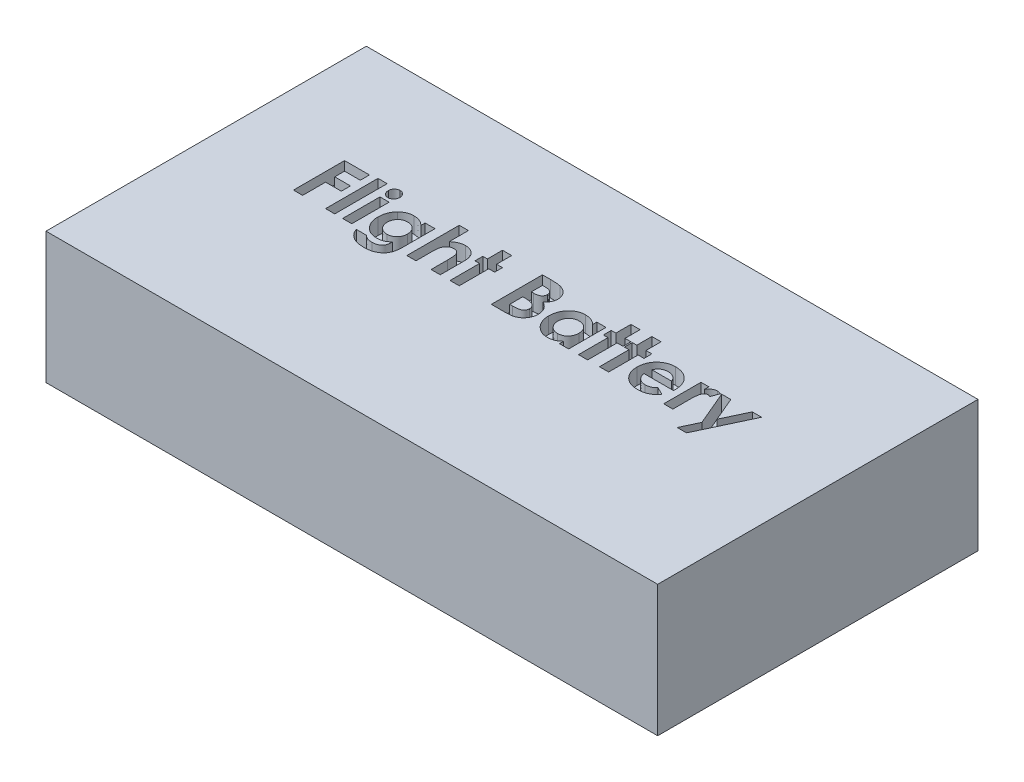
from build123d import *

# Parameters (mm, degrees)
SKETCH1_W           = 38
SKETCH1_H           = 19.9
BOSS_EXTRUDE1_DEPTH = 8.15
SKETCH3_W           = 0.569871795
SKETCH3_H           = 3.256410256
SKETCH3_H_2         = 2.320192307
CUT_EXTRUDE1_DEPTH  = 1


with BuildPart() as part:
    # Sketch1 → Boss-Extrude1 (new body)
    with BuildSketch(Plane(origin=(0, 0, 0), x_dir=(1, 0, 0), z_dir=(0, 1, 0))):
        with Locations((0.345454545, -0.277272727)):
            Rectangle(SKETCH1_W, SKETCH1_H)
    extrude(amount=BOSS_EXTRUDE1_DEPTH)

    # Sketch3 → Cut-Extrude1 (cut)
    # profile 1 of 14: a face of its own
    with BuildSketch(Plane(origin=(0, 8.15, 0), x_dir=(1, 0, 0), z_dir=(0, 1, 0))):
        Polygon((-13.17740164, 2.844430953), (-11.630606768, 2.844430953), (-11.630606768, 2.274559158), (-12.607529845, 2.274559158), (-12.607529845, 1.663982235), (-11.630606768, 1.663982235), (-11.630606768, 1.09411044), (-12.607529845, 1.09411044), (-12.607529845, -0.330569047), (-13.17740164, -0.330569047), align=None)
    # profile 2 of 14: a face of its own
    with BuildSketch(Plane(origin=(0, 8.15, 0), x_dir=(1, 0, 0), z_dir=(0, 1, 0))):
        with Locations((-10.897914461, 1.297636081)):
            Rectangle(SKETCH3_W, SKETCH3_H)
    # profile 3 of 14: a face of its own
    with BuildSketch(Plane(origin=(0, 8.15, 0), x_dir=(1, 0, 0), z_dir=(0, 1, 0))):
        with BuildLine():
            add(Edge.make_bspline(
                [(-9.840853162, 2.966546337), (-9.816291692, 2.965341259), (-9.768062879, 2.96297497), (-9.69896854, 2.939908925), (-9.635553941, 2.903707456), (-9.579493676, 2.854038178), (-9.53286799, 2.794723975), (-9.497244235, 2.728317781), (-9.477399725, 2.654741856), (-9.474643616, 2.603916378), (-9.473234973, 2.577939566)],
                knots=[0, 0, 0, 0, 0.989868614, 1.943702388, 2.910836514, 3.924849579, 4.949916355, 5.946401046, 6.950409252, 8, 8, 8, 8], degree=3))
            add(Edge.make_bspline(
                [(-9.473234973, 2.577939566), (-9.474593217, 2.55215419), (-9.477239819, 2.501910156), (-9.497700968, 2.429333059), (-9.53189491, 2.362959119), (-9.578898235, 2.304525842), (-9.634350733, 2.255656517), (-9.696379675, 2.218797832), (-9.764811889, 2.197014945), (-9.812292337, 2.194450849), (-9.836401039, 2.193148901)],
                knots=[0, 0, 0, 0, 1.05296456, 2.051751585, 3.055639087, 4.085634717, 5.099016424, 6.062201612, 7.016062274, 8, 8, 8, 8], degree=3))
            add(Edge.make_bspline(
                [(-9.836401039, 2.193148901), (-9.861176911, 2.194349672), (-9.909825313, 2.196707433), (-9.979486367, 2.219827448), (-10.043746755, 2.255743807), (-10.09956383, 2.306427905), (-10.146723485, 2.366163581), (-10.180791181, 2.434115768), (-10.202101367, 2.508194803), (-10.204630868, 2.559773042), (-10.205927281, 2.586207796)],
                knots=[0, 0, 0, 0, 0.989065327, 1.942068821, 2.907541208, 3.917690034, 4.939857478, 5.938239964, 6.943311734, 8, 8, 8, 8], degree=3))
            add(Edge.make_bspline(
                [(-10.205927281, 2.586207796), (-10.204516429, 2.611555321), (-10.201745013, 2.661346875), (-10.181781632, 2.733286991), (-10.146974728, 2.798576793), (-10.100684891, 2.856805194), (-10.045117025, 2.905547954), (-9.981740494, 2.94064996), (-9.913111163, 2.962763312), (-9.865187862, 2.965272308), (-9.840853162, 2.966546337)],
                knots=[0, 0, 0, 0, 1.038616768, 2.040212704, 3.031499824, 4.052181184, 5.074969369, 6.039807101, 7.004644834, 8, 8, 8, 8], degree=3))
        make_face()
    # profile 4 of 14: a face of its own
    with BuildSketch(Plane(origin=(0, 8.15, 0), x_dir=(1, 0, 0), z_dir=(0, 1, 0))):
        with Locations((-9.839581128, 0.829527107)):
            Rectangle(SKETCH3_W, SKETCH3_H_2)
    # profile 5 of 14: a face of its own
    with BuildSketch(Plane(origin=(0, 8.15, 0), x_dir=(1, 0, 0), z_dir=(0, 1, 0))):
        with BuildLine():
            Line((-7.315863178, 1.98962326), (-6.705286255, 1.98962326))
            Line((-6.705286255, 1.98962326), (-6.705286255, 0.010336401))
            add(Edge.make_bspline(
                [(-6.705286255, 0.010336401), (-6.70602001, -0.036962251), (-6.707436918, -0.128297806), (-6.718245501, -0.260666617), (-6.736270207, -0.383379785), (-6.762207122, -0.496611102), (-6.795705895, -0.599944387), (-6.836676165, -0.693723175), (-6.884284921, -0.778450374), (-6.923429916, -0.82795851), (-6.942520831, -0.852103502)],
                knots=[0, 0, 0, 0, 1.243822755, 2.401870584, 3.490053692, 4.503076575, 5.453444971, 6.342269266, 7.191528908, 8, 8, 8, 8], degree=3))
            add(Edge.make_bspline(
                [(-6.942520831, -0.852103502), (-6.969935648, -0.882174431), (-7.024626489, -0.942164046), (-7.121049506, -1.017868818), (-7.226684473, -1.082572327), (-7.342609413, -1.135599953), (-7.468686247, -1.175990087), (-7.604591095, -1.205078183), (-7.750410117, -1.223195619), (-7.851123414, -1.225101774), (-7.902907449, -1.226081868)],
                knots=[0, 0, 0, 0, 0.916003385, 1.827369254, 2.751972866, 3.703651841, 4.69362366, 5.730423306, 6.83304546, 8, 8, 8, 8], degree=3))
            add(Edge.make_bspline(
                [(-7.902907449, -1.226081868), (-7.95764617, -1.225234446), (-8.062922826, -1.223604637), (-8.21420321, -1.207661363), (-8.352005062, -1.181427807), (-8.476975498, -1.144494677), (-8.590278802, -1.096840259), (-8.694051588, -1.039699862), (-8.788094563, -0.971383814), (-8.873829231, -0.894585377), (-8.949267243, -0.80761802), (-9.013683904, -0.711277987), (-9.06856355, -0.606451415), (-9.095661, -0.531488425), (-9.10943289, -0.49338956)],
                knots=[0, 0, 0, 0, 1.29412125, 2.488928388, 3.592140377, 4.607309753, 5.564519828, 6.493640275, 7.402258018, 8.307438948, 9.210158992, 10.116782752, 11.042881838, 12, 12, 12, 12], degree=3))
            Line((-9.10943289, -0.49338956), (-8.475959332, -0.49338956))
            add(Edge.make_bspline(
                [(-8.475959332, -0.49338956), (-8.461320436, -0.50950559), (-8.43185661, -0.541942454), (-8.379743132, -0.583102636), (-8.322093814, -0.618333745), (-8.258443542, -0.647182346), (-8.188526924, -0.66911912), (-8.112819893, -0.685785178), (-8.030983341, -0.695177373), (-7.974588846, -0.696324118), (-7.94552063, -0.696915201)],
                knots=[0, 0, 0, 0, 0.888971165, 1.789239437, 2.70354581, 3.646217955, 4.638595249, 5.694475788, 6.811630907, 8, 8, 8, 8], degree=3))
            add(Edge.make_bspline(
                [(-7.94552063, -0.696915201), (-7.908786049, -0.696228836), (-7.838626219, -0.69491794), (-7.739365536, -0.680584712), (-7.650723799, -0.659171708), (-7.573980597, -0.626945658), (-7.507770498, -0.58823774), (-7.452535153, -0.543273459), (-7.406926822, -0.493746855), (-7.377094202, -0.447154422), (-7.359366549, -0.40488753), (-7.347295074, -0.368390677), (-7.338127867, -0.326321431), (-7.329783289, -0.279467174), (-7.323545582, -0.227224268), (-7.319413021, -0.169703389), (-7.315829471, -0.107157963), (-7.315851694, -0.063659541), (-7.315863178, -0.041181026)],
                knots=[0, 0, 0, 0, 1.656375485, 3.163532, 4.516250129, 5.759907703, 6.905105653, 7.965920022, 8.961443813, 9.932912751, 10.442911961, 11.026787936, 11.664959534, 12.383728702, 13.174001396, 14.037595414, 14.985895623, 16, 16, 16, 16], degree=3))
            add(Edge.make_bspline(
                [(-7.315863178, -0.041181026), (-7.340829088, -0.065667235), (-7.389547398, -0.11344946), (-7.468633963, -0.174409291), (-7.549593066, -0.224760611), (-7.632889967, -0.264787705), (-7.720181253, -0.294106846), (-7.811979617, -0.315164016), (-7.909330526, -0.327994486), (-7.97622225, -0.329698525), (-8.010394428, -0.330569047)],
                knots=[0, 0, 0, 0, 1.082007397, 2.111422008, 3.08419067, 4.02964304, 4.965866572, 5.929243163, 6.942137121, 8, 8, 8, 8], degree=3))
            add(Edge.make_bspline(
                [(-8.010394428, -0.330569047), (-8.048192835, -0.329695833), (-8.122442309, -0.327980529), (-8.231499506, -0.311311131), (-8.336130189, -0.285375175), (-8.436616097, -0.249269899), (-8.531931881, -0.201334862), (-8.623433921, -0.14430554), (-8.709426417, -0.075187368), (-8.791095737, 0.002161253), (-8.864910347, 0.088137631), (-8.929862639, 0.180476143), (-8.98461905, 0.278539843), (-9.029148584, 0.382237568), (-9.064627239, 0.491134001), (-9.089044107, 0.605818679), (-9.10396471, 0.726097964), (-9.105901158, 0.80807054), (-9.106888819, 0.849879671)],
                knots=[0, 0, 0, 0, 1.007560175, 1.979205489, 2.935124557, 3.879618859, 4.820364716, 5.775815361, 6.749909327, 7.75781854, 8.772289371, 9.766897274, 10.764314289, 11.762244114, 12.772609037, 13.814079916, 14.885097635, 16, 16, 16, 16], degree=3))
            add(Edge.make_bspline(
                [(-9.106888819, 0.849879671), (-9.106026195, 0.894453867), (-9.104340303, 0.981568579), (-9.087813746, 1.108810741), (-9.062097625, 1.229655658), (-9.025387187, 1.343850549), (-8.97715791, 1.450907237), (-8.918874757, 1.551165423), (-8.85108753, 1.645771597), (-8.797428277, 1.701895477), (-8.770435494, 1.730128068)],
                knots=[0, 0, 0, 0, 1.104124469, 2.157873671, 3.173961494, 4.162551312, 5.124378318, 6.07778831, 7.033049473, 8, 8, 8, 8], degree=3))
            add(Edge.make_bspline(
                [(-8.770435494, 1.730128068), (-8.744819732, 1.754201338), (-8.694342595, 1.801638918), (-8.611711677, 1.862509207), (-8.5261332, 1.91471773), (-8.436433359, 1.9567136), (-8.343246872, 1.990156812), (-8.246022065, 2.013552993), (-8.145242366, 2.027978538), (-8.076800692, 2.029539259), (-8.04219531, 2.030328389)],
                knots=[0, 0, 0, 0, 1.042068658, 2.053448347, 3.038272799, 4.011764631, 4.986555969, 5.970496305, 6.973845226, 8, 8, 8, 8], degree=3))
            add(Edge.make_bspline(
                [(-8.04219531, 2.030328389), (-8.009722075, 2.029416551), (-7.945374304, 2.027609688), (-7.850038864, 2.014861506), (-7.7577231, 1.992339991), (-7.667416217, 1.961377644), (-7.578161037, 1.921269449), (-7.49003469, 1.868699932), (-7.401250442, 1.805841647), (-7.344913734, 1.756726694), (-7.315863178, 1.731400103)],
                knots=[0, 0, 0, 0, 0.968122651, 1.918396369, 2.861262201, 3.796768263, 4.761417965, 5.77287463, 6.85156174, 8, 8, 8, 8], degree=3))
            Line((-7.315863178, 1.731400103), (-7.315863178, 1.98962326))
        make_face()
        with BuildLine():
            add(Edge.make_bspline(
                [(-7.906087537, 1.501161722), (-7.928366845, 1.500443807), (-7.97222906, 1.499030418), (-8.036692669, 1.491067243), (-8.097868932, 1.476035987), (-8.156503444, 1.456518426), (-8.21188331, 1.430263441), (-8.264115589, 1.398230257), (-8.313819399, 1.36104857), (-8.359413137, 1.318016749), (-8.401675406, 1.271519882), (-8.437160282, 1.220347429), (-8.468783632, 1.167413233), (-8.493375478, 1.110587248), (-8.513710778, 1.05141161), (-8.526138873, 0.988682127), (-8.536069305, 0.923545371), (-8.536697015, 0.878966401), (-8.537017025, 0.856239847)],
                knots=[0, 0, 0, 0, 1.059154978, 2.085203149, 3.079850876, 4.048488546, 5.017545358, 5.985239295, 6.956545898, 7.961752598, 8.960830395, 9.936516972, 10.916356752, 11.886198968, 12.873933111, 13.883774911, 14.921139228, 16, 16, 16, 16], degree=3))
            add(Edge.make_bspline(
                [(-8.537017025, 0.856239847), (-8.536670627, 0.832672094), (-8.53599078, 0.786417474), (-8.526472296, 0.719033133), (-8.512875283, 0.654542264), (-8.492335874, 0.593732094), (-8.46662243, 0.535803612), (-8.435734615, 0.480785284), (-8.397605334, 0.429992571), (-8.355264069, 0.382307676), (-8.308423188, 0.339195076), (-8.258003125, 0.301696378), (-8.205041934, 0.269312392), (-8.148394769, 0.244063167), (-8.089287298, 0.223602538), (-8.027126685, 0.208744033), (-7.962055778, 0.200716067), (-7.917768063, 0.199311149), (-7.895275238, 0.198597619)],
                knots=[0, 0, 0, 0, 1.097915424, 2.154794285, 3.166904039, 4.167166757, 5.140698173, 6.119085138, 7.101657521, 8.095747232, 9.089148684, 10.06378348, 11.021581144, 11.977080764, 12.949256321, 13.934658686, 14.951055324, 16, 16, 16, 16], degree=3))
            add(Edge.make_bspline(
                [(-7.895275238, 0.198597619), (-7.873189986, 0.198943899), (-7.829887789, 0.199622843), (-7.766722127, 0.209147097), (-7.706372535, 0.222918364), (-7.648947701, 0.242611309), (-7.59476632, 0.268314877), (-7.54310134, 0.298988187), (-7.495048677, 0.336106382), (-7.449697004, 0.378071056), (-7.408770013, 0.424734662), (-7.372645181, 0.475294067), (-7.342969941, 0.529758401), (-7.317692706, 0.587265376), (-7.298977389, 0.648626198), (-7.284767223, 0.713231541), (-7.276431622, 0.781394383), (-7.275588054, 0.828020395), (-7.27515805, 0.851787724)],
                knots=[0, 0, 0, 0, 1.047368431, 2.053558439, 3.025081491, 3.983010266, 4.928381778, 5.867249904, 6.829345556, 7.804873619, 8.796055618, 9.770545002, 10.747991713, 11.735078325, 12.747239243, 13.787476531, 14.872179528, 16, 16, 16, 16], degree=3))
            add(Edge.make_bspline(
                [(-7.27515805, 0.851787724), (-7.275575233, 0.875345114), (-7.276389802, 0.921342102), (-7.284843114, 0.988638866), (-7.298929785, 1.052433828), (-7.31790434, 1.113253493), (-7.342632431, 1.170734659), (-7.373641349, 1.224342333), (-7.409101364, 1.275066404), (-7.450854302, 1.321179077), (-7.49585778, 1.363828979), (-7.545472993, 1.399909886), (-7.597218661, 1.431789673), (-7.652841916, 1.45706284), (-7.711651857, 1.476968637), (-7.773742941, 1.490585335), (-7.838798503, 1.50014037), (-7.883366552, 1.50081685), (-7.906087537, 1.501161722)],
                knots=[0, 0, 0, 0, 1.111098411, 2.169475416, 3.193737863, 4.190319778, 5.171520483, 6.139320596, 7.107999188, 8.085777416, 9.069626166, 10.027970922, 10.974971434, 11.932846196, 12.904000912, 13.89897495, 14.928888274, 16, 16, 16, 16], degree=3))
        make_face(mode=Mode.SUBTRACT)
    # profile 6 of 14: a face of its own
    with BuildSketch(Plane(origin=(0, 8.15, 0), x_dir=(1, 0, 0), z_dir=(0, 1, 0))):
        with BuildLine():
            Line((-6.13541446, 2.925841209), (-5.565542666, 2.925841209))
            Line((-5.565542666, 2.925841209), (-5.565542666, 1.738396297))
            add(Edge.make_bspline(
                [(-5.565542666, 1.738396297), (-5.536837015, 1.761741428), (-5.480884729, 1.807245132), (-5.393093758, 1.866525661), (-5.305484371, 1.917112345), (-5.217126904, 1.958109394), (-5.128404685, 1.99023638), (-5.039164503, 2.013020302), (-4.94932045, 2.027968567), (-4.889090339, 2.029540942), (-4.858927081, 2.030328389)],
                knots=[0, 0, 0, 0, 1.13710654, 2.216417683, 3.252896077, 4.244436563, 5.207303112, 6.149540546, 7.073289332, 8, 8, 8, 8], degree=3))
            add(Edge.make_bspline(
                [(-4.858927081, 2.030328389), (-4.830062867, 2.0295625), (-4.773399992, 2.028058998), (-4.690272119, 2.017198985), (-4.610652217, 1.998511703), (-4.534344147, 1.972822793), (-4.461872894, 1.938274995), (-4.392296048, 1.897806611), (-4.326440626, 1.849321701), (-4.286371352, 1.811947168), (-4.266158651, 1.793093813)],
                knots=[0, 0, 0, 0, 1.056403236, 2.073808271, 3.062028718, 4.046096703, 5.014652014, 5.995532726, 6.988858718, 8, 8, 8, 8], degree=3))
            add(Edge.make_bspline(
                [(-4.266158651, 1.793093813), (-4.249558688, 1.77547708), (-4.216117913, 1.739988011), (-4.174468321, 1.678805677), (-4.138504314, 1.612162933), (-4.109198775, 1.539433542), (-4.087403796, 1.460583649), (-4.070530062, 1.376262831), (-4.061198528, 1.285550402), (-4.060046888, 1.223030269), (-4.059452922, 1.190785119)],
                knots=[0, 0, 0, 0, 0.887296576, 1.787466942, 2.706642908, 3.663267187, 4.658426068, 5.705361056, 6.816525637, 8, 8, 8, 8], degree=3))
            Line((-4.059452922, 1.190785119), (-4.059452922, -0.330569047))
            Line((-4.059452922, -0.330569047), (-4.629324717, -0.330569047))
            Line((-4.629324717, -0.330569047), (-4.629324717, 0.678154911))
            add(Edge.make_bspline(
                [(-4.629324717, 0.678154911), (-4.629435444, 0.710168764), (-4.629647388, 0.771446582), (-4.631550644, 0.859443137), (-4.634658722, 0.939384643), (-4.638909161, 1.011295258), (-4.644843702, 1.074874457), (-4.65068074, 1.130577951), (-4.658871472, 1.178138733), (-4.671136055, 1.229818042), (-4.691095579, 1.285093234), (-4.720100017, 1.344014212), (-4.758841975, 1.392642129), (-4.803676212, 1.432747969), (-4.85551507, 1.463358263), (-4.912502768, 1.485966495), (-4.975613543, 1.498680805), (-5.019359092, 1.50031315), (-5.042100158, 1.501161722)],
                knots=[0, 0, 0, 0, 1.461461505, 2.797388094, 4.017818807, 5.113567707, 6.085313608, 6.932873269, 7.669572396, 8.286941306, 9.355291607, 10.346554054, 11.270113241, 12.175128673, 13.078071705, 14.003657132, 14.962203834, 16, 16, 16, 16], degree=3))
            add(Edge.make_bspline(
                [(-5.042100158, 1.501161722), (-5.071725028, 1.500003588), (-5.129748677, 1.497735253), (-5.212957156, 1.474385451), (-5.289706031, 1.437478126), (-5.359099572, 1.386326233), (-5.419568679, 1.322256451), (-5.470232458, 1.247160268), (-5.511672656, 1.161788808), (-5.529583856, 1.099534464), (-5.538829925, 1.067397699)],
                knots=[0, 0, 0, 0, 0.993549393, 1.945978497, 2.879753144, 3.843180486, 4.826017097, 5.826060929, 6.877775219, 8, 8, 8, 8], degree=3))
            add(Edge.make_bspline(
                [(-5.538829925, 1.067397699), (-5.541132216, 1.057464693), (-5.546382193, 1.034814188), (-5.550402725, 0.996168536), (-5.55636913, 0.949452565), (-5.55843878, 0.894386328), (-5.562315726, 0.831054758), (-5.563710028, 0.75935539), (-5.565113736, 0.679220816), (-5.565395093, 0.623034485), (-5.565542666, 0.593564566)],
                knots=[0, 0, 0, 0, 0.514379255, 1.17295301, 1.959069106, 2.891908278, 3.953016936, 5.163065833, 6.51201855, 8, 8, 8, 8], degree=3))
            Line((-5.565542666, 0.593564566), (-5.565542666, -0.330569047))
            Line((-5.565542666, -0.330569047), (-6.13541446, -0.330569047))
            Line((-6.13541446, -0.330569047), (-6.13541446, 2.925841209))
        make_face()
    # profile 7 of 14: a face of its own
    with BuildSketch(Plane(origin=(0, 8.15, 0), x_dir=(1, 0, 0), z_dir=(0, 1, 0))):
        Polygon((-3.448875999, 2.925841209), (-2.879004204, 2.925841209), (-2.879004204, 1.98962326), (-2.51265805, 1.98962326), (-2.51265805, 1.501161722), (-2.879004204, 1.501161722), (-2.879004204, -0.330569047), (-3.448875999, -0.330569047), (-3.448875999, 1.501161722), (-3.733811896, 1.501161722), (-3.733811896, 1.98962326), (-3.448875999, 1.98962326), align=None)
    # profile 8 of 14: a face of its own
    with BuildSketch(Plane(origin=(0, 8.15, 0), x_dir=(1, 0, 0), z_dir=(0, 1, 0))):
        with BuildLine():
            Line((-0.884452922, -0.330569047), (-0.884452922, 2.844430953))
            Line((-0.884452922, 2.844430953), (-0.375638819, 2.844430953))
            add(Edge.make_bspline(
                [(-0.375638819, 2.844430953), (-0.340018651, 2.844435018), (-0.2710943, 2.844442884), (-0.171654449, 2.840950883), (-0.079432385, 2.836433588), (0.005278405, 2.831379786), (0.082622106, 2.822671075), (0.152481103, 2.813493045), (0.214994975, 2.802424906), (0.253643905, 2.792496443), (0.271827126, 2.787825384)],
                knots=[0, 0, 0, 0, 1.311965854, 2.538629056, 3.664479157, 4.713267157, 5.663616078, 6.530575999, 7.308677837, 8, 8, 8, 8], degree=3))
            add(Edge.make_bspline(
                [(0.271827126, 2.787825384), (0.295703542, 2.781236771), (0.342556735, 2.768307799), (0.409665459, 2.74219718), (0.473327445, 2.713173376), (0.533464963, 2.680062644), (0.589708746, 2.642465244), (0.641845046, 2.600082793), (0.690998316, 2.55461652), (0.735423236, 2.504799293), (0.775576043, 2.452158164), (0.810461634, 2.396706927), (0.840772741, 2.339293468), (0.865029566, 2.279195277), (0.883306628, 2.216689121), (0.896674395, 2.152041911), (0.905338518, 2.085049089), (0.906157164, 2.039471683), (0.906572719, 2.016336001)],
                knots=[0, 0, 0, 0, 1.099996261, 2.158545794, 3.195537121, 4.207578794, 5.205712374, 6.197378256, 7.190519799, 8.17788031, 9.159561366, 10.129234751, 11.085776129, 12.040971148, 13.00380137, 13.975669004, 14.972423361, 16, 16, 16, 16], degree=3))
            add(Edge.make_bspline(
                [(0.906572719, 2.016336001), (0.905486165, 1.986612722), (0.903347418, 1.9281061), (0.889684954, 1.842170458), (0.864065705, 1.760948923), (0.83054354, 1.682944616), (0.784963877, 1.608448491), (0.72708652, 1.53749597), (0.657848893, 1.467902318), (0.604739811, 1.426185618), (0.577115588, 1.404487042)],
                knots=[0, 0, 0, 0, 0.986156485, 1.941127874, 2.875419072, 3.804401753, 4.751181392, 5.761612777, 6.835722519, 8, 8, 8, 8], degree=3))
            add(Edge.make_bspline(
                [(0.577115588, 1.404487042), (0.599500933, 1.393059518), (0.643392402, 1.370653304), (0.705705393, 1.333824176), (0.763400421, 1.294651728), (0.816736172, 1.253924125), (0.864593869, 1.209914864), (0.908949636, 1.165159821), (0.947615189, 1.117094716), (0.982191092, 1.067432682), (1.012243905, 1.015454607), (1.038416591, 0.96124827), (1.06052372, 0.904628491), (1.079244609, 0.845883417), (1.093206653, 0.784810995), (1.102310202, 0.721389381), (1.109280449, 0.655834875), (1.109822669, 0.611180783), (1.11009836, 0.588476425)],
                knots=[0, 0, 0, 0, 1.164658916, 2.283573913, 3.35186032, 4.395461096, 5.390182219, 6.362969632, 7.312859996, 8.245001507, 9.165155236, 10.092416118, 11.032087915, 11.979892451, 12.947605196, 13.931445124, 14.948243989, 16, 16, 16, 16], degree=3))
            add(Edge.make_bspline(
                [(1.11009836, 0.588476425), (1.108309307, 0.5451124), (1.104778618, 0.459533671), (1.078963944, 0.333884442), (1.034209503, 0.214757576), (0.974113516, 0.102626535), (0.900063697, 0.000737328), (0.814927641, -0.088516732), (0.719562472, -0.164068313), (0.631576578, -0.215059769), (0.555475708, -0.249279805), (0.492442779, -0.270436788), (0.42474675, -0.290036586), (0.351147591, -0.303799969), (0.272979555, -0.31639773), (0.1894805, -0.324175849), (0.100806482, -0.329446888), (0.039901333, -0.330187432), (0.008515828, -0.330569047)],
                knots=[0, 0, 0, 0, 1.284142165, 2.534249414, 3.780121997, 5.041676246, 6.291546858, 7.49970053, 8.684500223, 9.883330709, 10.50184324, 11.153274765, 11.851151195, 12.587658647, 13.369265475, 14.195992086, 15.070362669, 16, 16, 16, 16], degree=3))
            Line((0.008515828, -0.330569047), (-0.884452922, -0.330569047))
        make_face()
        with BuildLine():
            Line((-0.314581127, 2.274559158), (-0.314581127, 1.582571978))
            Line((-0.314581127, 1.582571978), (-0.163208932, 1.582571978))
            add(Edge.make_bspline(
                [(-0.163208932, 1.582571978), (-0.14263609, 1.582751381), (-0.102921465, 1.583097708), (-0.045557901, 1.587558274), (0.007780949, 1.595168276), (0.056892783, 1.605786144), (0.102235096, 1.619269287), (0.143518227, 1.635492413), (0.180560663, 1.65528639), (0.223595405, 1.684770392), (0.269086232, 1.728157421), (0.309131295, 1.790838973), (0.332717569, 1.86292252), (0.335344444, 1.913761419), (0.336700924, 1.940013885)],
                knots=[0, 0, 0, 0, 1.065314748, 2.056525647, 2.977365736, 3.853934255, 4.656397591, 5.425096493, 6.14721249, 6.826394842, 8.123232004, 9.372140726, 10.643011755, 12, 12, 12, 12], degree=3))
            add(Edge.make_bspline(
                [(0.336700924, 1.940013885), (0.335615492, 1.964603682), (0.333516852, 2.012147066), (0.309768506, 2.078902212), (0.27288263, 2.138060933), (0.229333668, 2.178550239), (0.188323859, 2.206203242), (0.153208743, 2.224411566), (0.114667267, 2.240711473), (0.071953309, 2.253174778), (0.025310788, 2.262526804), (-0.025033726, 2.269394747), (-0.079167095, 2.274069361), (-0.116557128, 2.27439239), (-0.135860174, 2.274559158)],
                knots=[0, 0, 0, 0, 1.347982417, 2.606269829, 3.849316587, 5.153353503, 5.842674298, 6.568177932, 7.326619318, 8.142485038, 9.012069166, 9.942760135, 10.937925643, 12, 12, 12, 12], degree=3))
            Line((-0.135860174, 2.274559158), (-0.314581127, 2.274559158))
        make_face(mode=Mode.SUBTRACT)
        with BuildLine():
            Line((-0.314581127, 1.053405312), (-0.314581127, 0.239302748))
            Line((-0.314581127, 0.239302748), (-0.150488579, 0.239302748))
            add(Edge.make_bspline(
                [(-0.150488579, 0.239302748), (-0.118047273, 0.239488084), (-0.055674815, 0.239844415), (0.033673621, 0.244149747), (0.114913687, 0.25190935), (0.187830126, 0.26159659), (0.252534625, 0.274721284), (0.308808466, 0.29140765), (0.357423372, 0.309765559), (0.398087847, 0.332439757), (0.431308393, 0.3588269), (0.461286453, 0.385795194), (0.485728695, 0.41690567), (0.505067853, 0.45082284), (0.52180586, 0.486704177), (0.531901044, 0.525950836), (0.539587163, 0.567399638), (0.54001015, 0.596068879), (0.540226565, 0.610737042)],
                knots=[0, 0, 0, 0, 1.753078804, 3.370512758, 4.83203934, 6.162291463, 7.344201807, 8.395507345, 9.331626367, 10.147333109, 10.898971645, 11.62040215, 12.321813352, 13.025280112, 13.727906689, 14.453419512, 15.208716525, 16, 16, 16, 16], degree=3))
            add(Edge.make_bspline(
                [(0.540226565, 0.610737042), (0.539749308, 0.627510319), (0.53881974, 0.660180148), (0.531227943, 0.707930591), (0.517431168, 0.752508797), (0.500053456, 0.795054693), (0.475871448, 0.834044985), (0.447131957, 0.870828981), (0.412407315, 0.904161062), (0.37335743, 0.936057275), (0.327809605, 0.963984137), (0.275742471, 0.988215637), (0.21687317, 1.008452893), (0.151019348, 1.02456581), (0.078469705, 1.03824062), (-0.001305294, 1.046405991), (-0.087641253, 1.052478936), (-0.147508013, 1.053089503), (-0.178473355, 1.053405312)],
                knots=[0, 0, 0, 0, 0.845221588, 1.646264278, 2.427170338, 3.19324141, 3.95557735, 4.731569926, 5.540061037, 6.376114724, 7.268642756, 8.224665384, 9.265483498, 10.400594375, 11.639216012, 12.983232105, 14.439614077, 16, 16, 16, 16], degree=3))
            Line((-0.178473355, 1.053405312), (-0.314581127, 1.053405312))
        make_face(mode=Mode.SUBTRACT)
    # profile 9 of 14: a face of its own
    with BuildSketch(Plane(origin=(0, 8.15, 0), x_dir=(1, 0, 0), z_dir=(0, 1, 0))):
        with BuildLine():
            Line((3.348880411, 1.98962326), (3.918752206, 1.98962326))
            Line((3.918752206, 1.98962326), (3.918752206, -0.330569047))
            Line((3.918752206, -0.330569047), (3.348880411, -0.330569047))
            Line((3.348880411, -0.330569047), (3.348880411, -0.077434031))
            add(Edge.make_bspline(
                [(3.348880411, -0.077434031), (3.320643474, -0.102073923), (3.265841154, -0.149895088), (3.179490432, -0.211944266), (3.092887383, -0.263126818), (3.005615877, -0.303890929), (2.916334588, -0.333991029), (2.824400726, -0.355784205), (2.728490346, -0.368636174), (2.66329179, -0.370385682), (2.630180491, -0.371274176)],
                knots=[0, 0, 0, 0, 1.129196829, 2.191548051, 3.199897424, 4.157751732, 5.089409408, 6.034969131, 7.002052659, 8, 8, 8, 8], degree=3))
            add(Edge.make_bspline(
                [(2.630180491, -0.371274176), (2.593011586, -0.370437991), (2.519563723, -0.368785644), (2.411787139, -0.351392024), (2.307718131, -0.324767212), (2.207441176, -0.287089774), (2.111138718, -0.238267201), (2.018073752, -0.179573343), (1.929841694, -0.108947693), (1.845708043, -0.029446043), (1.768675777, 0.058006337), (1.701333443, 0.15219562), (1.64456886, 0.251785941), (1.598064675, 0.356447109), (1.561483127, 0.466102312), (1.535405719, 0.58109934), (1.520020018, 0.701479267), (1.518115702, 0.783477358), (1.517149642, 0.825074983)],
                knots=[0, 0, 0, 0, 0.980476535, 1.937477201, 2.874147792, 3.812856188, 4.758993464, 5.720109578, 6.712210464, 7.737600662, 8.772720504, 9.783789959, 10.789002326, 11.793715968, 12.802552247, 13.835794126, 14.902098527, 16, 16, 16, 16], degree=3))
            add(Edge.make_bspline(
                [(1.517149642, 0.825074983), (1.518163525, 0.868149379), (1.52015237, 0.952644606), (1.534700649, 1.076637334), (1.560296831, 1.194485704), (1.595199066, 1.306352954), (1.64009473, 1.41225841), (1.694774649, 1.51237558), (1.759982692, 1.606442772), (1.835123402, 1.692858897), (1.916256913, 1.77206345), (2.003055427, 1.841017294), (2.094161605, 1.899596794), (2.189672263, 1.947420398), (2.289573761, 1.984376059), (2.39347169, 2.011393665), (2.501827284, 2.027605177), (2.575639993, 2.029413113), (2.613008016, 2.030328389)],
                knots=[0, 0, 0, 0, 1.136281865, 2.228943489, 3.287578264, 4.313574083, 5.316051562, 6.317280042, 7.318008486, 8.329309503, 9.333984563, 10.305318864, 11.248632312, 12.186624717, 13.117503092, 14.05354244, 15.014596925, 16, 16, 16, 16], degree=3))
            add(Edge.make_bspline(
                [(2.613008016, 2.030328389), (2.647622912, 2.029609257), (2.716113317, 2.028186354), (2.816784342, 2.012736357), (2.914420718, 1.989369332), (3.008489831, 1.956075528), (3.099763269, 1.914035327), (3.18667107, 1.861355822), (3.271114422, 1.800251108), (3.322638143, 1.752527033), (3.348880411, 1.728220015)],
                knots=[0, 0, 0, 0, 1.017011718, 2.012299608, 2.98747302, 3.965332399, 4.941441765, 5.936729654, 6.94912688, 8, 8, 8, 8], degree=3))
            Line((3.348880411, 1.728220015), (3.348880411, 1.98962326))
        make_face()
        with BuildLine():
            add(Edge.make_bspline(
                [(2.73257933, 1.501161722), (2.709871618, 1.500464971), (2.665365987, 1.499099385), (2.599914366, 1.490885287), (2.537362251, 1.476411682), (2.478155758, 1.455030037), (2.421412494, 1.428984079), (2.367994114, 1.396361946), (2.31745974, 1.357803277), (2.270106569, 1.314241578), (2.226937177, 1.266359306), (2.189722642, 1.214109373), (2.158096299, 1.158899617), (2.131348632, 1.100564043), (2.112203372, 1.038412359), (2.097040333, 0.973253671), (2.089171698, 0.904555664), (2.087745362, 0.857740099), (2.087021437, 0.83397923)],
                knots=[0, 0, 0, 0, 1.04836806, 2.054732945, 3.03993516, 4.00574415, 4.955904794, 5.917688631, 6.888591924, 7.88601754, 8.884115178, 9.859153345, 10.841239365, 11.818093293, 12.814750328, 13.83810466, 14.90274714, 16, 16, 16, 16], degree=3))
            add(Edge.make_bspline(
                [(2.087021437, 0.83397923), (2.087734304, 0.810002836), (2.089139001, 0.762757629), (2.097167561, 0.69348013), (2.111784971, 0.627369626), (2.133111221, 0.564960576), (2.159155519, 0.505410874), (2.190857286, 0.448995349), (2.229797355, 0.396711497), (2.273004589, 0.347322107), (2.321329203, 0.303219298), (2.372149521, 0.264060053), (2.426159709, 0.231295538), (2.482773796, 0.20481505), (2.541801214, 0.183235678), (2.60398199, 0.168943976), (2.668706984, 0.159807561), (2.712831721, 0.158535256), (2.7351234, 0.157892491)],
                knots=[0, 0, 0, 0, 1.099136573, 2.165835871, 3.191374663, 4.196217796, 5.183857741, 6.167377911, 7.154730987, 8.166690795, 9.170734848, 10.148332609, 11.103258353, 12.059567475, 13.009337315, 13.978056681, 14.978520572, 16, 16, 16, 16], degree=3))
            add(Edge.make_bspline(
                [(2.7351234, 0.157892491), (2.758254069, 0.158593148), (2.803602754, 0.159966817), (2.870122185, 0.168105952), (2.9335146, 0.182632626), (2.993516251, 0.204136685), (3.051043607, 0.229995685), (3.105577535, 0.261980357), (3.15652626, 0.300450544), (3.204147814, 0.344406043), (3.247783788, 0.392679302), (3.285512971, 0.44561441), (3.31837647, 0.501518356), (3.3442221, 0.561712914), (3.364747154, 0.62514496), (3.379473407, 0.692208166), (3.387483635, 0.762974835), (3.388876046, 0.811275844), (3.38958554, 0.835887283)],
                knots=[0, 0, 0, 0, 1.050008698, 2.058587853, 3.036635738, 3.995319155, 4.947022481, 5.895997462, 6.858296291, 7.838991643, 8.833936038, 9.806048392, 10.784806122, 11.771666913, 12.772873988, 13.80724452, 14.882696879, 16, 16, 16, 16], degree=3))
            add(Edge.make_bspline(
                [(3.38958554, 0.835887283), (3.388884862, 0.860075417), (3.387516236, 0.907321869), (3.379438861, 0.976610963), (3.36460806, 1.042357354), (3.344505445, 1.104681892), (3.318200014, 1.163442073), (3.285311649, 1.217986387), (3.247996334, 1.270204589), (3.203877247, 1.31717372), (3.15651367, 1.360810947), (3.104815661, 1.398117768), (3.050411989, 1.430269821), (2.992968396, 1.456667897), (2.93195298, 1.476018687), (2.868452232, 1.491001296), (2.801475409, 1.499094455), (2.755919458, 1.500461388), (2.73257933, 1.501161722)],
                knots=[0, 0, 0, 0, 1.106611376, 2.161533483, 3.185006901, 4.184773755, 5.152708835, 6.122342771, 7.094156588, 8.082475533, 9.064254463, 10.03606828, 10.992420271, 11.951521816, 12.920622147, 13.915721683, 14.932141191, 16, 16, 16, 16], degree=3))
        make_face(mode=Mode.SUBTRACT)
    # profile 10 of 14: a face of its own
    with BuildSketch(Plane(origin=(0, 8.15, 0), x_dir=(1, 0, 0), z_dir=(0, 1, 0))):
        Polygon((4.529329129, 2.925841209), (5.099200924, 2.925841209), (5.099200924, 1.98962326), (5.465547078, 1.98962326), (5.465547078, 1.501161722), (5.099200924, 1.501161722), (5.099200924, -0.330569047), (4.529329129, -0.330569047), (4.529329129, 1.501161722), (4.244393232, 1.501161722), (4.244393232, 1.98962326), (4.529329129, 1.98962326), align=None)
    # profile 11 of 14: a face of its own
    with BuildSketch(Plane(origin=(0, 8.15, 0), x_dir=(1, 0, 0), z_dir=(0, 1, 0))):
        Polygon((5.831893232, 2.925841209), (6.401765027, 2.925841209), (6.401765027, 1.98962326), (6.768111181, 1.98962326), (6.768111181, 1.501161722), (6.401765027, 1.501161722), (6.401765027, -0.330569047), (5.831893232, -0.330569047), (5.831893232, 1.501161722), (5.546957334, 1.501161722), (5.546957334, 1.98962326), (5.831893232, 1.98962326), align=None)
    # profile 12 of 14: a face of its own
    with BuildSketch(Plane(origin=(0, 8.15, 0), x_dir=(1, 0, 0), z_dir=(0, 1, 0))):
        with BuildLine():
            Line((9.412036461, 0.687059158), (7.582213745, 0.687059158))
            add(Edge.make_bspline(
                [(7.582213745, 0.687059158), (7.585944605, 0.665797656), (7.593276041, 0.624017127), (7.609196515, 0.563327284), (7.629513426, 0.5061342), (7.653861966, 0.452361423), (7.681831616, 0.401724676), (7.714455896, 0.354461465), (7.751320997, 0.310613538), (7.792213773, 0.270371461), (7.836452618, 0.234313688), (7.883822988, 0.202724799), (7.934373767, 0.176823843), (7.98752541, 0.154992024), (8.043675081, 0.137699012), (8.102905419, 0.125772351), (8.165059412, 0.118727228), (8.207400611, 0.117708232), (8.229043673, 0.117187363)],
                knots=[0, 0, 0, 0, 1.091296461, 2.144483647, 3.168565212, 4.157007626, 5.126487748, 6.090021542, 7.05641414, 8.019231907, 8.98705074, 9.938580405, 10.892824166, 11.854447369, 12.841318655, 13.858982407, 14.905600794, 16, 16, 16, 16], degree=3))
            add(Edge.make_bspline(
                [(8.229043673, 0.117187363), (8.255168317, 0.117877079), (8.306615434, 0.119235332), (8.381985845, 0.131281025), (8.454880011, 0.149475513), (8.524608097, 0.176532245), (8.591977793, 0.21021312), (8.655879987, 0.252175345), (8.717420777, 0.301192648), (8.75496791, 0.338975167), (8.77411078, 0.358238044)],
                knots=[0, 0, 0, 0, 1.021034703, 2.010718019, 2.977989445, 3.954245119, 4.929443971, 5.918328161, 6.938689359, 8, 8, 8, 8], degree=3))
            Line((8.77411078, 0.358238044), (9.251124001, 0.131179751))
            add(Edge.make_bspline(
                [(9.251124001, 0.131179751), (9.236105518, 0.110426512), (9.206346947, 0.069304734), (9.157767077, 0.011435771), (9.10707089, -0.042558319), (9.054220577, -0.092322409), (8.999149109, -0.13771469), (8.942009682, -0.179288124), (8.881967227, -0.215926479), (8.820222282, -0.249402297), (8.755498465, -0.278100961), (8.687974894, -0.302574169), (8.617937572, -0.32469774), (8.544502076, -0.34155469), (8.468279904, -0.354898513), (8.389088718, -0.364374396), (8.306938954, -0.370227194), (8.251102239, -0.370921037), (8.222683496, -0.371274176)],
                knots=[0, 0, 0, 0, 1.028154879, 2.037251081, 3.030720504, 4.000128189, 4.949298328, 5.894184978, 6.834267904, 7.770992897, 8.712077017, 9.673380525, 10.653304757, 11.658697181, 12.695551717, 13.758623199, 14.859225354, 16, 16, 16, 16], degree=3))
            add(Edge.make_bspline(
                [(8.222683496, -0.371274176), (8.178961728, -0.37038282), (8.093335165, -0.368637152), (7.968090837, -0.352434855), (7.849143463, -0.325569699), (7.736157178, -0.289050646), (7.629620383, -0.240834055), (7.529480353, -0.181861165), (7.434736546, -0.113262604), (7.348283914, -0.03359867), (7.269523015, 0.053110786), (7.200344339, 0.14623082), (7.142456608, 0.245110838), (7.094918039, 0.349096432), (7.057969411, 0.458453764), (7.031331594, 0.573230555), (7.015002293, 0.693371985), (7.013238648, 0.775201711), (7.01234195, 0.816806754)],
                knots=[0, 0, 0, 0, 1.103565453, 2.161269334, 3.182010356, 4.179077853, 5.15417608, 6.128274628, 7.109042802, 8.101804412, 9.090965879, 10.063106201, 11.02526161, 11.978650795, 12.945248442, 13.93468508, 14.949922959, 16, 16, 16, 16], degree=3))
            add(Edge.make_bspline(
                [(7.01234195, 0.816806754), (7.013247473, 0.859469034), (7.01502905, 0.943405155), (7.031190999, 1.066320707), (7.058043056, 1.183598767), (7.095099766, 1.295400842), (7.141917169, 1.4020766), (7.200541422, 1.502692756), (7.269488685, 1.5975996), (7.347965849, 1.686353149), (7.434784722, 1.766462923), (7.527037976, 1.837856741), (7.625762172, 1.89734681), (7.729840654, 1.945414748), (7.838607698, 1.984468735), (7.9533205, 2.010455901), (8.073106271, 2.027904728), (8.154989186, 2.029511656), (8.196606774, 2.030328389)],
                knots=[0, 0, 0, 0, 1.079208495, 2.12329425, 3.130605359, 4.119693003, 5.099659317, 6.073216462, 7.060498243, 8.06384408, 9.066070512, 10.045757761, 11.010926815, 11.975797609, 12.942977511, 13.929384301, 14.947594487, 16, 16, 16, 16], degree=3))
            add(Edge.make_bspline(
                [(8.196606774, 2.030328389), (8.240537999, 2.029423205), (8.326792432, 2.027645969), (8.452909048, 2.01157523), (8.572646218, 1.984546254), (8.686514089, 1.948342975), (8.793058522, 1.898908382), (8.894620621, 1.841386721), (8.988764351, 1.77130535), (9.076493184, 1.692031266), (9.155686385, 1.604079417), (9.224910018, 1.508536772), (9.283810809, 1.406335769), (9.331550485, 1.297061964), (9.368461173, 1.181043405), (9.395123648, 1.058430767), (9.411328396, 0.928757689), (9.413059224, 0.839963101), (9.413944514, 0.794546137)],
                knots=[0, 0, 0, 0, 1.080001299, 2.120471247, 3.119684163, 4.095710327, 5.052285597, 6.002875087, 6.961153713, 7.931888285, 8.906493152, 9.865905668, 10.82813294, 11.801621613, 12.7925306, 13.817193356, 14.883530496, 16, 16, 16, 16], degree=3))
            Line((9.413944514, 0.794546137), (9.412036461, 0.687059158))
        make_face()
        with BuildLine():
            add(Edge.make_bspline(
                [(8.844072719, 1.134815568), (8.83331889, 1.163835797), (8.811937476, 1.221535573), (8.763637751, 1.301147184), (8.699545562, 1.370094072), (8.625001748, 1.431133299), (8.539830774, 1.480676549), (8.446716524, 1.51654747), (8.346835946, 1.538056125), (8.278123491, 1.540578712), (8.24303606, 1.54186685)],
                knots=[0, 0, 0, 0, 0.954238005, 1.897273737, 2.851915805, 3.847685534, 4.862635127, 5.880135777, 6.917509367, 8, 8, 8, 8], degree=3))
            add(Edge.make_bspline(
                [(8.24303606, 1.54186685), (8.204714873, 1.540629437), (8.129804932, 1.538210552), (8.021752441, 1.512484821), (7.91982923, 1.474089937), (7.859741082, 1.434503996), (7.829624602, 1.414663324)],
                knots=[0, 0, 0, 0, 1.044195649, 2.041185066, 3.018232172, 4, 4, 4, 4], degree=3))
            add(Edge.make_bspline(
                [(7.829624602, 1.414663324), (7.810834168, 1.399552235), (7.770773922, 1.367336163), (7.718747567, 1.30306816), (7.667501173, 1.225254035), (7.638364773, 1.16614871), (7.622918873, 1.134815568)],
                knots=[0, 0, 0, 0, 0.82159062, 1.751589201, 2.808063854, 4, 4, 4, 4], degree=3))
            Line((7.622918873, 1.134815568), (8.844072719, 1.134815568))
        make_face(mode=Mode.SUBTRACT)
    # profile 13 of 14: a face of its own
    with BuildSketch(Plane(origin=(0, 8.15, 0), x_dir=(1, 0, 0), z_dir=(0, 1, 0))):
        with BuildLine():
            Line((9.820995796, 1.98962326), (10.309457334, 1.98962326))
            Line((10.309457334, 1.98962326), (10.309457334, 1.704051345))
            add(Edge.make_bspline(
                [(10.309457334, 1.704051345), (10.323274974, 1.7294302), (10.350282123, 1.779034224), (10.399896521, 1.845617804), (10.45689555, 1.901692637), (10.519231061, 1.948431579), (10.587091978, 1.984859995), (10.658661109, 2.010819834), (10.733326179, 2.027690133), (10.784260159, 2.029442638), (10.810003208, 2.030328389)],
                knots=[0, 0, 0, 0, 1.09866127, 2.147379032, 3.14564304, 4.131443017, 5.102343063, 6.064490016, 7.021754664, 8, 8, 8, 8], degree=3))
            add(Edge.make_bspline(
                [(10.810003208, 2.030328389), (10.828695874, 2.029453082), (10.866760816, 2.027670644), (10.924777144, 2.017309307), (10.983630546, 1.99857404), (11.022361156, 1.981705422), (11.042149642, 1.973086802)],
                knots=[0, 0, 0, 0, 0.931404136, 1.896671404, 2.925354185, 4, 4, 4, 4], degree=3))
            Line((11.042149642, 1.973086802), (10.865336741, 1.490349422))
            add(Edge.make_bspline(
                [(10.865336741, 1.490349422), (10.849532193, 1.497985416), (10.819825726, 1.512338144), (10.776697094, 1.529275843), (10.737556072, 1.539610399), (10.712741383, 1.541152405), (10.701244193, 1.54186685)],
                knots=[0, 0, 0, 0, 1.214386998, 2.282580073, 3.20428172, 4, 4, 4, 4], degree=3))
            add(Edge.make_bspline(
                [(10.701244193, 1.54186685), (10.690388611, 1.541393421), (10.66903381, 1.540462104), (10.637514721, 1.532481035), (10.607830302, 1.51871793), (10.578550064, 1.501086026), (10.551983892, 1.47657636), (10.525434129, 1.44820207), (10.502037057, 1.413170236), (10.47734636, 1.374178025), (10.456323114, 1.326451593), (10.438296329, 1.26947607), (10.422234318, 1.202592208), (10.411181462, 1.125444887), (10.400498432, 1.03878064), (10.394139631, 0.941963363), (10.389400336, 0.835299202), (10.389110559, 0.760843768), (10.388959538, 0.722040127)],
                knots=[0, 0, 0, 0, 0.544232178, 1.070598461, 1.618251235, 2.182094276, 2.777567932, 3.425210017, 4.127676488, 4.886675562, 5.738955394, 6.734782583, 7.883056018, 9.186093582, 10.642914445, 12.264202625, 14.053029461, 16, 16, 16, 16], degree=3))
            Line((10.388959538, 0.722040127), (10.390867591, 0.60882899))
            Line((10.390867591, 0.60882899), (10.390867591, -0.330569047))
            Line((10.390867591, -0.330569047), (9.820995796, -0.330569047))
            Line((9.820995796, -0.330569047), (9.820995796, 1.98962326))
        make_face()
    # profile 14 of 14: a face of its own
    with BuildSketch(Plane(origin=(0, 8.15, 0), x_dir=(1, 0, 0), z_dir=(0, 1, 0))):
        Polygon((11.101935299, 1.98962326), (11.672443112, 1.98962326), (12.305916669, 0.496889887), (13.006808096, 1.98962326), (13.586220155, 1.98962326), (12.094758817, -1.18537674), (11.515346757, -1.18537674), (12.005716349, -0.141671812), align=None)
    extrude(amount=-CUT_EXTRUDE1_DEPTH, mode=Mode.SUBTRACT)


solid = part.part
